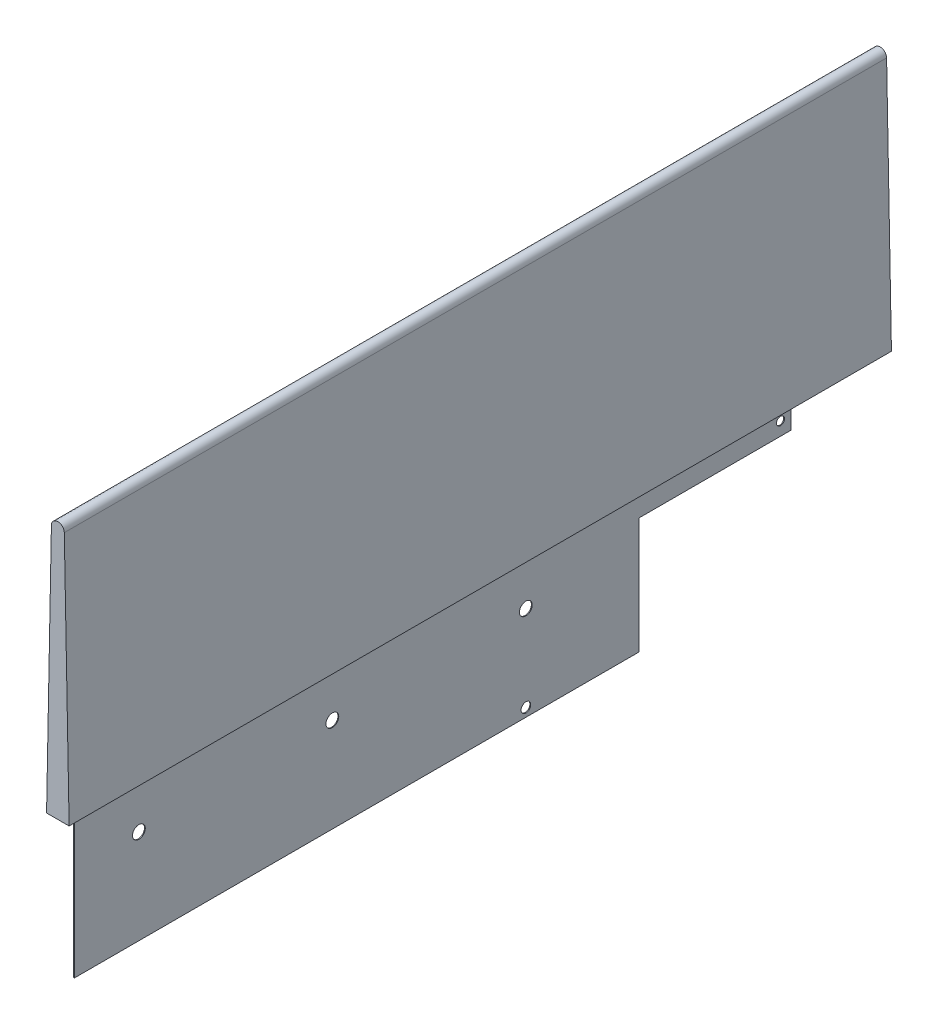
from build123d import *

# Parameters (mm, degrees)
EXTRUDE_1_DEPTH          = 145
EXTRUDE_1_DEPTH_BACK     = 110
SKETCH_3_R               = 1.985
EXTRUDE_2_DEPTH          = 0.127
CUT_EXTRUDE_1_DEPTH      = 166.641933097
CUT_EXTRUDE_1_DEPTH_BACK = 166.641933097
SKETCH_5_R               = 1.5
SKETCH_5_R_2             = 1.25
SKETCH_6_W               = 7.7
SKETCH_6_H               = 9
CUT_EXTRUDE_2_DEPTH      = 166.64466526
CUT_EXTRUDE_3_DEPTH      = 0.254


with BuildPart() as part:
    # 스케치1 → 보스-돌출1 (new, two sides: drawn at the far end of the back side and taken through both)
    with BuildSketch(Plane.XY.offset(-EXTRUDE_1_DEPTH_BACK)):
        with BuildLine():
            Line((-2, 78.038073346), (-3.5, 0))
            Line((-3.5, 0), (0, 0))
            Line((0, 0), (0, 80))
            ThreePointArc((0, 80), (-1.400817279, 79.427632252), (-2, 78.038073346))
        make_face()
        with BuildLine():
            Line((0, 80), (0, 0))
            Line((0, 0), (3.5, 0))
            Line((3.5, 0), (2, 78.038073346))
            ThreePointArc((2, 78.038073346), (1.400817279, 79.427632252), (0, 80))
        make_face()
    extrude(amount=EXTRUDE_1_DEPTH + EXTRUDE_1_DEPTH_BACK)


with BuildPart() as body_2:
    # 스케치3 → 보스-돌출2 (new, symmetric)
    with BuildSketch(Plane(origin=(0, 0, 0), x_dir=(0, 0, -1), z_dir=(1, 0, 0))):
        Polygon((90, 6), (-140, 6), (-140, -45), (35.019447481, -45), (35.019447481, -9), (90, -9), align=None)
        with Locations((-120, -15.783602029)):
            Circle(SKETCH_3_R, mode=Mode.SUBTRACT)
        with Locations((-60, -15.783602029)):
            Circle(SKETCH_3_R, mode=Mode.SUBTRACT)
        with Locations((0, -15.783602029)):
            Circle(SKETCH_3_R, mode=Mode.SUBTRACT)
    extrude(amount=EXTRUDE_2_DEPTH, both=True)

    # 스케치5 → 컷-돌출1 (cut, two sides: drawn at the far end of the back side and taken through both)
    with BuildSketch(Plane(origin=(0, 0, 0), x_dir=(0, 0, -1), z_dir=(1, 0, 0)).offset(-CUT_EXTRUDE_1_DEPTH_BACK)):
        with Locations((0.019447481, -42.334402401)):
            Circle(SKETCH_5_R)
        with Locations((78.961507376, -4.895337416)):
            Circle(SKETCH_5_R_2)
    extrude(amount=CUT_EXTRUDE_1_DEPTH + CUT_EXTRUDE_1_DEPTH_BACK, mode=Mode.SUBTRACT)

    # 스케치6 → 컷-돌출2 (cut, through all)
    with BuildSketch(Plane.ZY.offset(0.127)):
        with Locations((-86.15, -4.5)):
            Rectangle(SKETCH_6_W, SKETCH_6_H)
    extrude(amount=-CUT_EXTRUDE_2_DEPTH, mode=Mode.SUBTRACT)


with BuildPart() as cut_extrude_3_tool:
    # 스케치7 → 컷-돌출3 (new body)
    with BuildSketch(Plane.ZY.offset(0.127)):
        with BuildLine():
            Line((-87.273345879, 4.883972144), (-77.273345879, 4.883972144))
            ThreePointArc((-77.273345879, 4.883972144), (-76.573345879, 4.183972144), (-77.273345879, 3.483972144))
            Line((-77.273345879, 3.483972144), (-87.273345879, 3.483972144))
            ThreePointArc((-87.273345879, 3.483972144), (-87.973345879, 4.183972144), (-87.273345879, 4.883972144))
        make_face()
        with BuildLine():
            Line((-82.028488439, 2.390694467), (-72.028488439, 2.390694467))
            ThreePointArc((-72.028488439, 2.390694467), (-71.328488439, 1.690694467), (-72.028488439, 0.990694467))
            Line((-72.028488439, 0.990694467), (-82.028488439, 0.990694467))
            ThreePointArc((-82.028488439, 0.990694467), (-82.728488439, 1.690694467), (-82.028488439, 2.390694467))
        make_face()
        with BuildLine():
            Line((-72.273345879, 4.883972144), (-62.273345879, 4.883972144))
            ThreePointArc((-62.273345879, 4.883972144), (-61.573345879, 4.183972144), (-62.273345879, 3.483972144))
            Line((-62.273345879, 3.483972144), (-72.273345879, 3.483972144))
            ThreePointArc((-72.273345879, 3.483972144), (-72.973345879, 4.183972144), (-72.273345879, 4.883972144))
        make_face()
        with BuildLine():
            Line((-67.028488439, 2.390694467), (-57.028488439, 2.390694467))
            ThreePointArc((-57.028488439, 2.390694467), (-56.328488439, 1.690694467), (-57.028488439, 0.990694467))
            Line((-57.028488439, 0.990694467), (-67.028488439, 0.990694467))
            ThreePointArc((-67.028488439, 0.990694467), (-67.728488439, 1.690694467), (-67.028488439, 2.390694467))
        make_face()
        with BuildLine():
            Line((-57.273345879, 4.883972144), (-47.273345879, 4.883972144))
            ThreePointArc((-47.273345879, 4.883972144), (-46.573345879, 4.183972144), (-47.273345879, 3.483972144))
            Line((-47.273345879, 3.483972144), (-57.273345879, 3.483972144))
            ThreePointArc((-57.273345879, 3.483972144), (-57.973345879, 4.183972144), (-57.273345879, 4.883972144))
        make_face()
        with BuildLine():
            Line((-52.028488439, 2.390694467), (-42.028488439, 2.390694467))
            ThreePointArc((-42.028488439, 2.390694467), (-41.328488439, 1.690694467), (-42.028488439, 0.990694467))
            Line((-42.028488439, 0.990694467), (-52.028488439, 0.990694467))
            ThreePointArc((-52.028488439, 0.990694467), (-52.728488439, 1.690694467), (-52.028488439, 2.390694467))
        make_face()
        with BuildLine():
            Line((-42.273345879, 4.883972144), (-32.273345879, 4.883972144))
            ThreePointArc((-32.273345879, 4.883972144), (-31.573345879, 4.183972144), (-32.273345879, 3.483972144))
            Line((-32.273345879, 3.483972144), (-42.273345879, 3.483972144))
            ThreePointArc((-42.273345879, 3.483972144), (-42.973345879, 4.183972144), (-42.273345879, 4.883972144))
        make_face()
        with BuildLine():
            Line((-37.028488439, 2.390694467), (-27.028488439, 2.390694467))
            ThreePointArc((-27.028488439, 2.390694467), (-26.328488439, 1.690694467), (-27.028488439, 0.990694467))
            Line((-27.028488439, 0.990694467), (-37.028488439, 0.990694467))
            ThreePointArc((-37.028488439, 0.990694467), (-37.728488439, 1.690694467), (-37.028488439, 2.390694467))
        make_face()
        with BuildLine():
            Line((-27.273345879, 4.883972144), (-17.273345879, 4.883972144))
            ThreePointArc((-17.273345879, 4.883972144), (-16.573345879, 4.183972144), (-17.273345879, 3.483972144))
            Line((-17.273345879, 3.483972144), (-27.273345879, 3.483972144))
            ThreePointArc((-27.273345879, 3.483972144), (-27.973345879, 4.183972144), (-27.273345879, 4.883972144))
        make_face()
        with BuildLine():
            Line((-22.028488439, 2.390694467), (-12.028488439, 2.390694467))
            ThreePointArc((-12.028488439, 2.390694467), (-11.328488439, 1.690694467), (-12.028488439, 0.990694467))
            Line((-12.028488439, 0.990694467), (-22.028488439, 0.990694467))
            ThreePointArc((-22.028488439, 0.990694467), (-22.728488439, 1.690694467), (-22.028488439, 2.390694467))
        make_face()
        with BuildLine():
            Line((-12.273345879, 4.883972144), (-2.273345879, 4.883972144))
            ThreePointArc((-2.273345879, 4.883972144), (-1.573345879, 4.183972144), (-2.273345879, 3.483972144))
            Line((-2.273345879, 3.483972144), (-12.273345879, 3.483972144))
            ThreePointArc((-12.273345879, 3.483972144), (-12.973345879, 4.183972144), (-12.273345879, 4.883972144))
        make_face()
        with BuildLine():
            Line((-7.028488439, 2.390694467), (2.971511561, 2.390694467))
            ThreePointArc((2.971511561, 2.390694467), (3.671511561, 1.690694467), (2.971511561, 0.990694467))
            Line((2.971511561, 0.990694467), (-7.028488439, 0.990694467))
            ThreePointArc((-7.028488439, 0.990694467), (-7.728488439, 1.690694467), (-7.028488439, 2.390694467))
        make_face()
        with BuildLine():
            Line((2.726654121, 4.883972144), (12.726654121, 4.883972144))
            ThreePointArc((12.726654121, 4.883972144), (13.426654121, 4.183972144), (12.726654121, 3.483972144))
            Line((12.726654121, 3.483972144), (2.726654121, 3.483972144))
            ThreePointArc((2.726654121, 3.483972144), (2.026654121, 4.183972144), (2.726654121, 4.883972144))
        make_face()
        with BuildLine():
            Line((7.971511561, 2.390694467), (17.971511561, 2.390694467))
            ThreePointArc((17.971511561, 2.390694467), (18.671511561, 1.690694467), (17.971511561, 0.990694467))
            Line((17.971511561, 0.990694467), (7.971511561, 0.990694467))
            ThreePointArc((7.971511561, 0.990694467), (7.271511561, 1.690694467), (7.971511561, 2.390694467))
        make_face()
        with BuildLine():
            Line((17.726654121, 4.883972144), (27.726654121, 4.883972144))
            ThreePointArc((27.726654121, 4.883972144), (28.426654121, 4.183972144), (27.726654121, 3.483972144))
            Line((27.726654121, 3.483972144), (17.726654121, 3.483972144))
            ThreePointArc((17.726654121, 3.483972144), (17.026654121, 4.183972144), (17.726654121, 4.883972144))
        make_face()
        with BuildLine():
            Line((22.971511561, 2.390694467), (32.971511561, 2.390694467))
            ThreePointArc((32.971511561, 2.390694467), (33.671511561, 1.690694467), (32.971511561, 0.990694467))
            Line((32.971511561, 0.990694467), (22.971511561, 0.990694467))
            ThreePointArc((22.971511561, 0.990694467), (22.271511561, 1.690694467), (22.971511561, 2.390694467))
        make_face()
        with BuildLine():
            Line((32.726654121, 4.883972144), (42.726654121, 4.883972144))
            ThreePointArc((42.726654121, 4.883972144), (43.426654121, 4.183972144), (42.726654121, 3.483972144))
            Line((42.726654121, 3.483972144), (32.726654121, 3.483972144))
            ThreePointArc((32.726654121, 3.483972144), (32.026654121, 4.183972144), (32.726654121, 4.883972144))
        make_face()
        with BuildLine():
            Line((37.971511561, 2.390694467), (47.971511561, 2.390694467))
            ThreePointArc((47.971511561, 2.390694467), (48.671511561, 1.690694467), (47.971511561, 0.990694467))
            Line((47.971511561, 0.990694467), (37.971511561, 0.990694467))
            ThreePointArc((37.971511561, 0.990694467), (37.271511561, 1.690694467), (37.971511561, 2.390694467))
        make_face()
        with BuildLine():
            Line((47.726654121, 4.883972144), (57.726654121, 4.883972144))
            ThreePointArc((57.726654121, 4.883972144), (58.426654121, 4.183972144), (57.726654121, 3.483972144))
            Line((57.726654121, 3.483972144), (47.726654121, 3.483972144))
            ThreePointArc((47.726654121, 3.483972144), (47.026654121, 4.183972144), (47.726654121, 4.883972144))
        make_face()
        with BuildLine():
            Line((52.971511561, 2.390694467), (62.971511561, 2.390694467))
            ThreePointArc((62.971511561, 2.390694467), (63.671511561, 1.690694467), (62.971511561, 0.990694467))
            Line((62.971511561, 0.990694467), (52.971511561, 0.990694467))
            ThreePointArc((52.971511561, 0.990694467), (52.271511561, 1.690694467), (52.971511561, 2.390694467))
        make_face()
        with BuildLine():
            Line((62.726654121, 4.883972144), (72.726654121, 4.883972144))
            ThreePointArc((72.726654121, 4.883972144), (73.426654121, 4.183972144), (72.726654121, 3.483972144))
            Line((72.726654121, 3.483972144), (62.726654121, 3.483972144))
            ThreePointArc((62.726654121, 3.483972144), (62.026654121, 4.183972144), (62.726654121, 4.883972144))
        make_face()
        with BuildLine():
            Line((67.971511561, 2.390694467), (77.971511561, 2.390694467))
            ThreePointArc((77.971511561, 2.390694467), (78.671511561, 1.690694467), (77.971511561, 0.990694467))
            Line((77.971511561, 0.990694467), (67.971511561, 0.990694467))
            ThreePointArc((67.971511561, 0.990694467), (67.271511561, 1.690694467), (67.971511561, 2.390694467))
        make_face()
        with BuildLine():
            Line((77.726654121, 4.883972144), (87.726654121, 4.883972144))
            ThreePointArc((87.726654121, 4.883972144), (88.426654121, 4.183972144), (87.726654121, 3.483972144))
            Line((87.726654121, 3.483972144), (77.726654121, 3.483972144))
            ThreePointArc((77.726654121, 3.483972144), (77.026654121, 4.183972144), (77.726654121, 4.883972144))
        make_face()
        with BuildLine():
            Line((82.971511561, 2.390694467), (92.971511561, 2.390694467))
            ThreePointArc((92.971511561, 2.390694467), (93.671511561, 1.690694467), (92.971511561, 0.990694467))
            Line((92.971511561, 0.990694467), (82.971511561, 0.990694467))
            ThreePointArc((82.971511561, 0.990694467), (82.271511561, 1.690694467), (82.971511561, 2.390694467))
        make_face()
        with BuildLine():
            Line((92.726654121, 4.883972144), (102.726654121, 4.883972144))
            ThreePointArc((102.726654121, 4.883972144), (103.426654121, 4.183972144), (102.726654121, 3.483972144))
            Line((102.726654121, 3.483972144), (92.726654121, 3.483972144))
            ThreePointArc((92.726654121, 3.483972144), (92.026654121, 4.183972144), (92.726654121, 4.883972144))
        make_face()
        with BuildLine():
            Line((97.971511561, 2.390694467), (107.971511561, 2.390694467))
            ThreePointArc((107.971511561, 2.390694467), (108.671511561, 1.690694467), (107.971511561, 0.990694467))
            Line((107.971511561, 0.990694467), (97.971511561, 0.990694467))
            ThreePointArc((97.971511561, 0.990694467), (97.271511561, 1.690694467), (97.971511561, 2.390694467))
        make_face()
        with BuildLine():
            Line((107.726654121, 4.883972144), (117.726654121, 4.883972144))
            ThreePointArc((117.726654121, 4.883972144), (118.426654121, 4.183972144), (117.726654121, 3.483972144))
            Line((117.726654121, 3.483972144), (107.726654121, 3.483972144))
            ThreePointArc((107.726654121, 3.483972144), (107.026654121, 4.183972144), (107.726654121, 4.883972144))
        make_face()
        with BuildLine():
            Line((112.971511561, 2.390694467), (122.971511561, 2.390694467))
            ThreePointArc((122.971511561, 2.390694467), (123.671511561, 1.690694467), (122.971511561, 0.990694467))
            Line((122.971511561, 0.990694467), (112.971511561, 0.990694467))
            ThreePointArc((112.971511561, 0.990694467), (112.271511561, 1.690694467), (112.971511561, 2.390694467))
        make_face()
        with BuildLine():
            Line((122.726654121, 4.883972144), (132.726654121, 4.883972144))
            ThreePointArc((132.726654121, 4.883972144), (133.426654121, 4.183972144), (132.726654121, 3.483972144))
            Line((132.726654121, 3.483972144), (122.726654121, 3.483972144))
            ThreePointArc((122.726654121, 3.483972144), (122.026654121, 4.183972144), (122.726654121, 4.883972144))
        make_face()
        with BuildLine():
            Line((127.971511561, 2.390694467), (137.971511561, 2.390694467))
            ThreePointArc((137.971511561, 2.390694467), (138.671511561, 1.690694467), (137.971511561, 0.990694467))
            Line((137.971511561, 0.990694467), (127.971511561, 0.990694467))
            ThreePointArc((127.971511561, 0.990694467), (127.271511561, 1.690694467), (127.971511561, 2.390694467))
        make_face()
    extrude(amount=-CUT_EXTRUDE_3_DEPTH)


with BuildPart() as part_1:
    add(part.part)

    # 컷-돌출3: cut by cut_extrude_3_tool
    add(cut_extrude_3_tool.part, mode=Mode.SUBTRACT)


with BuildPart() as body_2_1:
    add(body_2.part)

    # 컷-돌출3: cut by cut_extrude_3_tool
    add(cut_extrude_3_tool.part, mode=Mode.SUBTRACT)


solid = Compound([part_1.part, body_2_1.part])
